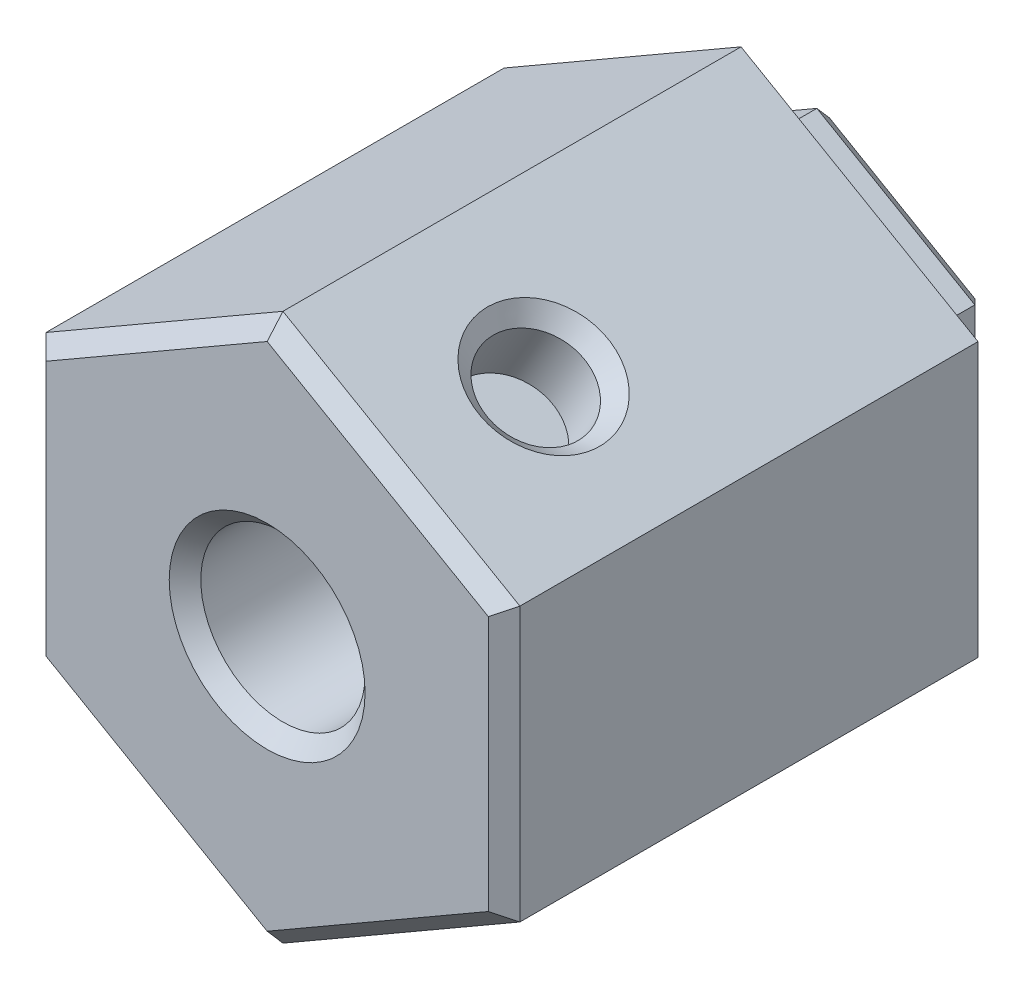
from build123d import *

# Parameters (mm, degrees)
BOSS_EXTRUDE1_DEPTH = 15
BOSS_EXTRUDE2_DEPTH = 2.8
SKETCH2_R           = 2.6
CUT_EXTRUDE1_DEPTH  = 22.168136432
SKETCH4_R           = 1.55
CUT_EXTRUDE3_DEPTH  = 2.5
CIRPATTERN1_COUNT   = 3
CHAMFER1_SIZE       = 0.5
CHAMFER2_SIZE       = 0.5
CHAMFER3_SIZE       = 1
CHAMFER4_SIZE       = 0.4


with BuildPart() as part:
    # Sketch1 → Boss-Extrude1 (new body)
    with BuildSketch(Plane.XY):
        Polygon((0, 8.660254038), (-7.5, 4.330127019), (-7.5, -4.330127019), (0, -8.660254038), (7.5, -4.330127019), (7.5, 4.330127019), align=None)
    extrude(amount=BOSS_EXTRUDE1_DEPTH)

    # Sketch3 → Boss-Extrude2 (add)
    with BuildSketch(Plane(origin=(0, 0, 0), x_dir=(-1, 0, 0), z_dir=(0, 0, -1))):
        Polygon((0, 5.773502692), (-5, 2.886751346), (-5, -2.886751346), (0, -5.773502692), (5, -2.886751346), (5, 2.886751346), align=None)
    extrude(amount=BOSS_EXTRUDE2_DEPTH)

    # Sketch2 → Cut-Extrude1 (cut, through all)
    with BuildSketch(Plane.XY.offset(15)):
        Circle(SKETCH2_R)
    extrude(amount=-CUT_EXTRUDE1_DEPTH, mode=Mode.SUBTRACT)

    # Sketch4 → Cut-Extrude3 (cut)
    with BuildSketch(Plane(origin=(3.75, 6.495190528, 0), x_dir=(0.8660254037844417, -0.4999999999999949, 0), z_dir=(0.4999999999999949, 0.8660254037844417, 0))):
        with Locations((0, -10)):
            Circle(SKETCH4_R)
    cut_extrude3 = extrude(amount=-CUT_EXTRUDE3_DEPTH, mode=Mode.SUBTRACT)

    # CirPattern1: Cut-Extrude3 ×3 about axis
    cirpattern1_axis = Axis((0, 0, 15), (0, 0, 1))
    for i in range(1, CIRPATTERN1_COUNT):
        add(cut_extrude3.rotate(cirpattern1_axis, i * 360 / CIRPATTERN1_COUNT), mode=Mode.SUBTRACT)

    # Chamfer1
    chamfer1_edges = [part.edges().sort_by_distance(p)[0] for p in [
        (7.5, 0, 15),
        (3.75, -6.495190528, 15),
        (-3.75, -6.495190528, 15),
        (-7.5, 0, 15),
        (-3.75, 6.495190528, 15),
        (3.75, 6.495190528, 15),
        (-2.6, 0, 15),
    ]]
    chamfer(chamfer1_edges, length=CHAMFER1_SIZE)

    # Chamfer2
    chamfer2_edges = [part.edges().sort_by_distance(p)[0] for p in [
        (-7.5, -1.55, 10),
        (5.092339376, -5.720190528, 10),
        (2.407660624, 7.270190528, 10),
    ]]
    chamfer(chamfer2_edges, length=CHAMFER2_SIZE)

    # Chamfer3
    chamfer3_edges = [part.edges().sort_by_distance(p)[0] for p in [
        (-2.6, 0, -2.8),
    ]]
    chamfer(chamfer3_edges, length=CHAMFER3_SIZE)

    # Chamfer4
    chamfer4_edges = [part.edges().sort_by_distance(p)[0] for p in [
        (-5, 0, -2.8),
        (-2.5, -4.330127019, -2.8),
        (2.5, -4.330127019, -2.8),
        (5, 0, -2.8),
        (2.5, 4.330127019, -2.8),
        (-2.5, 4.330127019, -2.8),
    ]]
    chamfer(chamfer4_edges, length=CHAMFER4_SIZE)


solid = part.part
